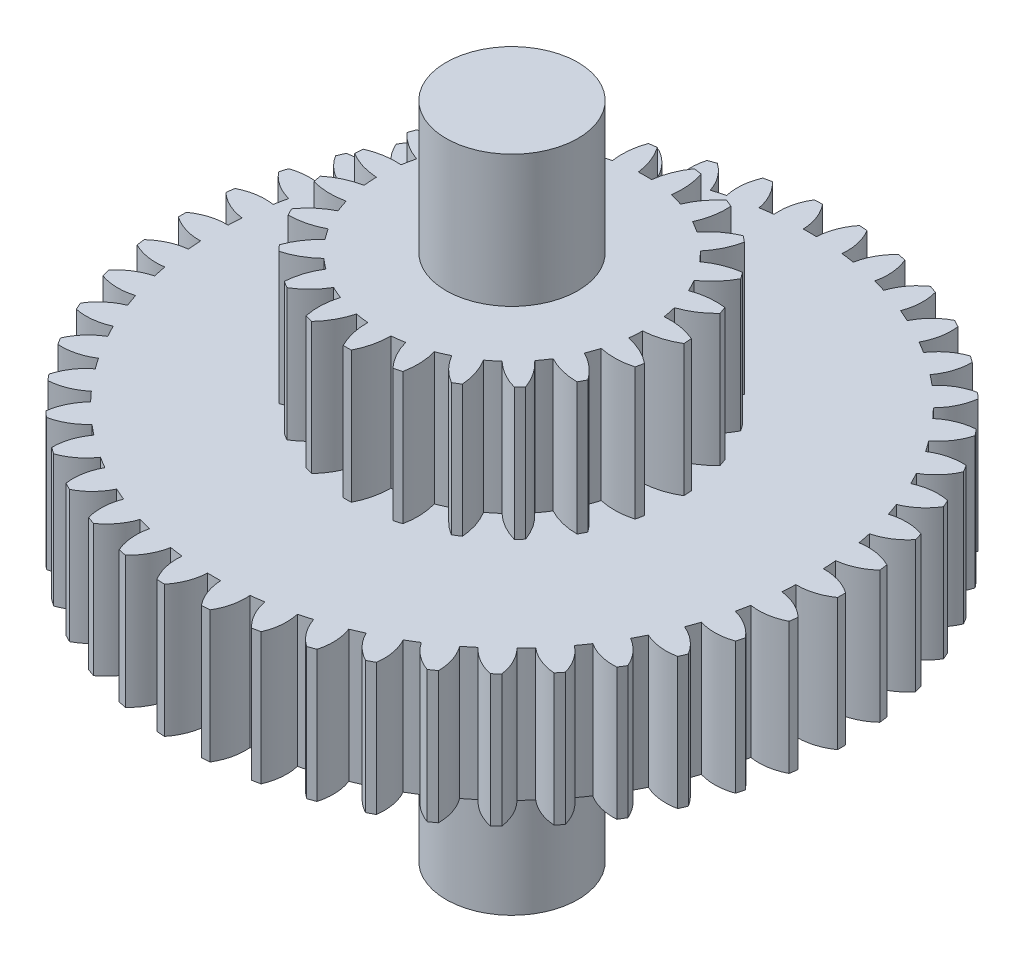
from build123d import *

# Parameters (mm, degrees)
BOSS_EXTRUDE1_DEPTH      = 1
BOSS_EXTRUDE2_DEPTH      = 2
BOSS_EXTRUDE2_DEPTH_BACK = 3
SKETCH2_R                = 0.5
BOSS_EXTRUDE3_DEPTH      = 1
SCALE1_SCALE             = 2
CUT_EXTRUDE1_DEPTH       = 2.5


with BuildPart() as part:
    # Sketch1 → Boss-Extrude1 (new body)
    with BuildSketch(Plane(origin=(0, 0, 0), x_dir=(1, 0, 0), z_dir=(0, 1, 0))):
        with BuildLine():
            ThreePointArc((-1.122849348, 2.23365381), (-1.150162594, 2.219713046), (-1.17730279, 2.20543831))
            ThreePointArc((-1.17730279, 2.20543831), (-1.174225974, 2.07727607), (-1.131251341, 1.956494417))
            ThreePointArc((-1.131251341, 1.956494417), (-1.174259727, 1.930987854), (-1.216693282, 1.904536022))
            ThreePointArc((-1.216693282, 1.904536022), (-1.3041624, 1.998259979), (-1.416540223, 2.059954804))
            ThreePointArc((-1.416540223, 2.059954804), (-1.441700805, 2.042424733), (-1.466644473, 2.024587363))
            ThreePointArc((-1.466644473, 2.024587363), (-1.446144892, 1.898037792), (-1.387124094, 1.784232818))
            ThreePointArc((-1.387124094, 1.784232818), (-1.426258754, 1.753107517), (-1.464695223, 1.721124023))
            ThreePointArc((-1.464695223, 1.721124023), (-1.564111726, 1.802064654), (-1.683843634, 1.847882739))
            ThreePointArc((-1.683843634, 1.847882739), (-1.706382858, 1.827089911), (-1.728665344, 1.806022184))
            ThreePointArc((-1.728665344, 1.806022184), (-1.691124866, 1.683442662), (-1.617157349, 1.578734337))
            ThreePointArc((-1.617157349, 1.578734337), (-1.651689279, 1.542570104), (-1.685412664, 1.505650741))
            ThreePointArc((-1.685412664, 1.505650741), (-1.79492461, 1.572300274), (-1.919780224, 1.601388114))
            ThreePointArc((-1.919780224, 1.601388114), (-1.939278227, 1.577719861), (-1.958484451, 1.553814228))
            ThreePointArc((-1.958484451, 1.553814228), (-1.904602384, 1.43748818), (-1.817066023, 1.343827023))
            ThreePointArc((-1.817066023, 1.343827023), (-1.846351958, 1.303297528), (-1.874734055, 1.262130034))
            ThreePointArc((-1.874734055, 1.262130034), (-1.992301445, 1.313246914), (-2.119954941, 1.325062658))
            ThreePointArc((-2.119954941, 1.325062658), (-2.136048511, 1.298959875), (-2.151820698, 1.272661654))
            ThreePointArc((-2.151820698, 1.272661654), (-2.082600763, 1.164756013), (-1.983126195, 1.083886754))
            ThreePointArc((-1.983126195, 1.083886754), (-2.006620594, 1.039746985), (-2.029132698, 0.995098232))
            ThreePointArc((-2.029132698, 0.995098232), (-2.152565474, 1.02973025), (-2.280638908, 1.024053793))
            ThreePointArc((-2.280638908, 1.024053793), (-2.293028254, 0.996002725), (-2.305072596, 0.967801801))
            ThreePointArc((-2.305072596, 0.967801801), (-2.22180423, 0.870326645), (-2.112244478, 0.803755726))
            ThreePointArc((-2.112244478, 0.803755726), (-2.129509684, 0.756827924), (-2.145732439, 0.709529634))
            ThreePointArc((-2.145732439, 0.709529634), (-2.272731281, 0.727031659), (-2.398838888, 0.703968742))
            ThreePointArc((-2.398838888, 0.703968742), (-2.407293218, 0.674491928), (-2.415385354, 0.644913631))
            ThreePointArc((-2.415385354, 0.644913631), (-2.319619689, 0.559684739), (-2.202015642, 0.508652249))
            ThreePointArc((-2.202015642, 0.508652249), (-2.212730038, 0.459810589), (-2.222361244, 0.41074384))
            ThreePointArc((-2.222361244, 0.41074384), (-2.350560404, 0.410789844), (-2.472353038, 0.370770087))
            ThreePointArc((-2.472353038, 0.370770087), (-2.476714865, 0.340416623), (-2.480704053, 0.310011941))
            ThreePointArc((-2.480704053, 0.310011941), (-2.374225021, 0.238616965), (-2.250767422, 0.204073543))
            ThreePointArc((-2.250767422, 0.204073543), (-2.254731418, 0.154227854), (-2.257591664, 0.104306666))
            ThreePointArc((-2.257591664, 0.104306666), (-2.384603034, 0.086895792), (-2.499811928, 0.030664685))
            ThreePointArc((-2.499811928, 0.030664685), (-2.5, 0), (-2.499811928, -0.030664685))
            ThreePointArc((-2.499811928, -0.030664685), (-2.384603034, -0.086895792), (-2.257591664, -0.104306666))
            ThreePointArc((-2.257591664, -0.104306666), (-2.254731418, -0.154227854), (-2.250767422, -0.204073543))
            ThreePointArc((-2.250767422, -0.204073543), (-2.374225021, -0.238616965), (-2.480704053, -0.310011941))
            ThreePointArc((-2.480704053, -0.310011941), (-2.476714865, -0.340416623), (-2.472353038, -0.370770087))
            ThreePointArc((-2.472353038, -0.370770087), (-2.350560404, -0.410789844), (-2.222361244, -0.41074384))
            ThreePointArc((-2.222361244, -0.41074384), (-2.212730038, -0.459810589), (-2.202015642, -0.508652249))
            ThreePointArc((-2.202015642, -0.508652249), (-2.319619689, -0.559684739), (-2.415385354, -0.644913631))
            ThreePointArc((-2.415385354, -0.644913631), (-2.407293218, -0.674491928), (-2.398838888, -0.703968742))
            ThreePointArc((-2.398838888, -0.703968742), (-2.272731281, -0.727031659), (-2.145732439, -0.709529634))
            ThreePointArc((-2.145732439, -0.709529634), (-2.129509684, -0.756827924), (-2.112244478, -0.803755726))
            ThreePointArc((-2.112244478, -0.803755726), (-2.22180423, -0.870326645), (-2.305072596, -0.967801801))
            ThreePointArc((-2.305072596, -0.967801801), (-2.293028254, -0.996002725), (-2.280638908, -1.024053793))
            ThreePointArc((-2.280638908, -1.024053793), (-2.152565474, -1.02973025), (-2.029132698, -0.995098232))
            ThreePointArc((-2.029132698, -0.995098232), (-2.006620594, -1.039746985), (-1.983126195, -1.083886754))
            ThreePointArc((-1.983126195, -1.083886754), (-2.082600763, -1.164756013), (-2.151820698, -1.272661654))
            ThreePointArc((-2.151820698, -1.272661654), (-2.136048511, -1.298959875), (-2.119954941, -1.325062658))
            ThreePointArc((-2.119954941, -1.325062658), (-1.992301445, -1.313246914), (-1.874734055, -1.262130034))
            ThreePointArc((-1.874734055, -1.262130034), (-1.846351958, -1.303297528), (-1.817066023, -1.343827023))
            ThreePointArc((-1.817066023, -1.343827023), (-1.904602384, -1.43748818), (-1.958484451, -1.553814228))
            ThreePointArc((-1.958484451, -1.553814228), (-1.939278227, -1.577719861), (-1.919780224, -1.601388114))
            ThreePointArc((-1.919780224, -1.601388114), (-1.79492461, -1.572300274), (-1.685412664, -1.505650741))
            ThreePointArc((-1.685412664, -1.505650741), (-1.651689279, -1.542570104), (-1.617157349, -1.578734337))
            ThreePointArc((-1.617157349, -1.578734337), (-1.691124866, -1.683442662), (-1.728665344, -1.806022184))
            ThreePointArc((-1.728665344, -1.806022184), (-1.706382858, -1.827089911), (-1.683843634, -1.847882739))
            ThreePointArc((-1.683843634, -1.847882739), (-1.564111726, -1.802064654), (-1.464695223, -1.721124023))
            ThreePointArc((-1.464695223, -1.721124023), (-1.426258754, -1.753107517), (-1.387124094, -1.784232818))
            ThreePointArc((-1.387124094, -1.784232818), (-1.446144892, -1.898037792), (-1.466644473, -2.024587363))
            ThreePointArc((-1.466644473, -2.024587363), (-1.441700805, -2.042424733), (-1.416540223, -2.059954804))
            ThreePointArc((-1.416540223, -2.059954804), (-1.3041624, -1.998259979), (-1.216693282, -1.904536022))
            ThreePointArc((-1.216693282, -1.904536022), (-1.174259727, -1.930987854), (-1.131251341, -1.956494417))
            ThreePointArc((-1.131251341, -1.956494417), (-1.174225974, -2.07727607), (-1.17730279, -2.20543831))
            ThreePointArc((-1.17730279, -2.20543831), (-1.150162594, -2.219713046), (-1.122849348, -2.23365381))
            ThreePointArc((-1.122849348, -2.23365381), (-1.019918995, -2.157231501), (-0.946026647, -2.052470118))
            ThreePointArc((-0.946026647, -2.052470118), (-0.900386463, -2.072897541), (-0.854305516, -2.092310227))
            ThreePointArc((-0.854305516, -2.092310227), (-0.880433448, -2.217818624), (-0.866030184, -2.345206115))
            ThreePointArc((-0.866030184, -2.345206115), (-0.83719903, -2.355652305), (-0.808241914, -2.365744071))
            ThreePointArc((-0.808241914, -2.365744071), (-0.71667643, -2.276017883), (-0.657737325, -2.162170579))
            ThreePointArc((-0.657737325, -2.162170579), (-0.609740703, -2.176193069), (-0.561445596, -2.189150256))
            ThreePointArc((-0.561445596, -2.189150256), (-0.570240113, -2.317047414), (-0.538625074, -2.441287167))
            ThreePointArc((-0.538625074, -2.441287167), (-0.508640033, -2.447710219), (-0.478578463, -2.453764996))
            ThreePointArc((-0.478578463, -2.453764996), (-0.400083539, -2.352406357), (-0.357195602, -2.231593893))
            ThreePointArc((-0.357195602, -2.231593893), (-0.307736627, -2.238950238), (-0.258127007, -2.245210558))
            ThreePointArc((-0.258127007, -2.245210558), (-0.249424284, -2.373113995), (-0.201186398, -2.491891658))
            ThreePointArc((-0.201186398, -2.491891658), (-0.170606033, -2.494171923), (-0.14, -2.496076922))
            ThreePointArc((-0.14, -2.496076922), (-0.076037848, -2.384973952), (-0.05, -2.259446835))
            ThreePointArc((-0.05, -2.259446835), (0, -2.26), (0.05, -2.259446835))
            ThreePointArc((0.05, -2.259446835), (0.076037848, -2.384973952), (0.14, -2.496076922))
            ThreePointArc((0.14, -2.496076922), (0.170606033, -2.494171923), (0.201186398, -2.491891658))
            ThreePointArc((0.201186398, -2.491891658), (0.249424284, -2.373113995), (0.258127007, -2.245210558))
            ThreePointArc((0.258127007, -2.245210558), (0.307736627, -2.238950238), (0.357195602, -2.231593893))
            ThreePointArc((0.357195602, -2.231593893), (0.400083539, -2.352406357), (0.478578463, -2.453764996))
            ThreePointArc((0.478578463, -2.453764996), (0.508640033, -2.447710219), (0.538625074, -2.441287167))
            ThreePointArc((0.538625074, -2.441287167), (0.570240113, -2.317047414), (0.561445596, -2.189150256))
            ThreePointArc((0.561445596, -2.189150256), (0.609740703, -2.176193069), (0.657737325, -2.162170579))
            ThreePointArc((0.657737325, -2.162170579), (0.71667643, -2.276017883), (0.808241914, -2.365744071))
            ThreePointArc((0.808241914, -2.365744071), (0.83719903, -2.355652305), (0.866030184, -2.345206115))
            ThreePointArc((0.866030184, -2.345206115), (0.880433448, -2.217818624), (0.854305516, -2.092310227))
            ThreePointArc((0.854305516, -2.092310227), (0.900386463, -2.072897541), (0.946026647, -2.052470118))
            ThreePointArc((0.946026647, -2.052470118), (1.019918995, -2.157231501), (1.122849348, -2.23365381))
            ThreePointArc((1.122849348, -2.23365381), (1.150162594, -2.219713046), (1.17730279, -2.20543831))
            ThreePointArc((1.17730279, -2.20543831), (1.174225974, -2.07727607), (1.131251341, -1.956494417))
            ThreePointArc((1.131251341, -1.956494417), (1.174259727, -1.930987854), (1.216693282, -1.904536022))
            ThreePointArc((1.216693282, -1.904536022), (1.3041624, -1.998259979), (1.416540223, -2.059954804))
            ThreePointArc((1.416540223, -2.059954804), (1.441700805, -2.042424733), (1.466644473, -2.024587363))
            ThreePointArc((1.466644473, -2.024587363), (1.446144892, -1.898037792), (1.387124094, -1.784232818))
            ThreePointArc((1.387124094, -1.784232818), (1.426258754, -1.753107517), (1.464695223, -1.721124023))
            ThreePointArc((1.464695223, -1.721124023), (1.564111726, -1.802064654), (1.683843634, -1.847882739))
            ThreePointArc((1.683843634, -1.847882739), (1.706382858, -1.827089911), (1.728665344, -1.806022184))
            ThreePointArc((1.728665344, -1.806022184), (1.691124866, -1.683442662), (1.617157349, -1.578734337))
            ThreePointArc((1.617157349, -1.578734337), (1.651689279, -1.542570104), (1.685412664, -1.505650741))
            ThreePointArc((1.685412664, -1.505650741), (1.79492461, -1.572300274), (1.919780224, -1.601388114))
            ThreePointArc((1.919780224, -1.601388114), (1.939278227, -1.577719861), (1.958484451, -1.553814228))
            ThreePointArc((1.958484451, -1.553814228), (1.904602384, -1.43748818), (1.817066023, -1.343827023))
            ThreePointArc((1.817066023, -1.343827023), (1.846351958, -1.303297528), (1.874734055, -1.262130034))
            ThreePointArc((1.874734055, -1.262130034), (1.992301445, -1.313246914), (2.119954941, -1.325062658))
            ThreePointArc((2.119954941, -1.325062658), (2.136048511, -1.298959875), (2.151820698, -1.272661654))
            ThreePointArc((2.151820698, -1.272661654), (2.082600763, -1.164756013), (1.983126195, -1.083886754))
            ThreePointArc((1.983126195, -1.083886754), (2.006620594, -1.039746985), (2.029132698, -0.995098232))
            ThreePointArc((2.029132698, -0.995098232), (2.152565474, -1.02973025), (2.280638908, -1.024053793))
            ThreePointArc((2.280638908, -1.024053793), (2.293028254, -0.996002725), (2.305072596, -0.967801801))
            ThreePointArc((2.305072596, -0.967801801), (2.22180423, -0.870326645), (2.112244478, -0.803755726))
            ThreePointArc((2.112244478, -0.803755726), (2.129509684, -0.756827924), (2.145732439, -0.709529634))
            ThreePointArc((2.145732439, -0.709529634), (2.272731281, -0.727031659), (2.398838888, -0.703968742))
            ThreePointArc((2.398838888, -0.703968742), (2.407293218, -0.674491928), (2.415385354, -0.644913631))
            ThreePointArc((2.415385354, -0.644913631), (2.319619689, -0.559684739), (2.202015642, -0.508652249))
            ThreePointArc((2.202015642, -0.508652249), (2.212730038, -0.459810589), (2.222361244, -0.41074384))
            ThreePointArc((2.222361244, -0.41074384), (2.350560404, -0.410789844), (2.472353038, -0.370770087))
            ThreePointArc((2.472353038, -0.370770087), (2.476714865, -0.340416623), (2.480704053, -0.310011941))
            ThreePointArc((2.480704053, -0.310011941), (2.374225021, -0.238616965), (2.250767422, -0.204073543))
            ThreePointArc((2.250767422, -0.204073543), (2.254731418, -0.154227854), (2.257591664, -0.104306666))
            ThreePointArc((2.257591664, -0.104306666), (2.384603034, -0.086895792), (2.499811928, -0.030664685))
            ThreePointArc((2.499811928, -0.030664685), (2.5, 0), (2.499811928, 0.030664685))
            ThreePointArc((2.499811928, 0.030664685), (2.384603034, 0.086895792), (2.257591664, 0.104306666))
            ThreePointArc((2.257591664, 0.104306666), (2.254731418, 0.154227854), (2.250767422, 0.204073543))
            ThreePointArc((2.250767422, 0.204073543), (2.374225021, 0.238616965), (2.480704053, 0.310011941))
            ThreePointArc((2.480704053, 0.310011941), (2.476714865, 0.340416623), (2.472353038, 0.370770087))
            ThreePointArc((2.472353038, 0.370770087), (2.350560404, 0.410789844), (2.222361244, 0.41074384))
            ThreePointArc((2.222361244, 0.41074384), (2.212730038, 0.459810589), (2.202015642, 0.508652249))
            ThreePointArc((2.202015642, 0.508652249), (2.319619689, 0.559684739), (2.415385354, 0.644913631))
            ThreePointArc((2.415385354, 0.644913631), (2.407293218, 0.674491928), (2.398838888, 0.703968742))
            ThreePointArc((2.398838888, 0.703968742), (2.272731281, 0.727031659), (2.145732439, 0.709529634))
            ThreePointArc((2.145732439, 0.709529634), (2.129509684, 0.756827924), (2.112244478, 0.803755726))
            ThreePointArc((2.112244478, 0.803755726), (2.22180423, 0.870326645), (2.305072596, 0.967801801))
            ThreePointArc((2.305072596, 0.967801801), (2.293028254, 0.996002725), (2.280638908, 1.024053793))
            ThreePointArc((2.280638908, 1.024053793), (2.152565474, 1.02973025), (2.029132698, 0.995098232))
            ThreePointArc((2.029132698, 0.995098232), (2.006620594, 1.039746985), (1.983126195, 1.083886754))
            ThreePointArc((1.983126195, 1.083886754), (2.082600763, 1.164756013), (2.151820698, 1.272661654))
            ThreePointArc((2.151820698, 1.272661654), (2.136048511, 1.298959875), (2.119954941, 1.325062658))
            ThreePointArc((2.119954941, 1.325062658), (1.992301445, 1.313246914), (1.874734055, 1.262130034))
            ThreePointArc((1.874734055, 1.262130034), (1.846351958, 1.303297528), (1.817066023, 1.343827023))
            ThreePointArc((1.817066023, 1.343827023), (1.904602384, 1.43748818), (1.958484451, 1.553814228))
            ThreePointArc((1.958484451, 1.553814228), (1.939278227, 1.577719861), (1.919780224, 1.601388114))
            ThreePointArc((1.919780224, 1.601388114), (1.79492461, 1.572300274), (1.685412664, 1.505650741))
            ThreePointArc((1.685412664, 1.505650741), (1.651689279, 1.542570104), (1.617157349, 1.578734337))
            ThreePointArc((1.617157349, 1.578734337), (1.691124866, 1.683442662), (1.728665344, 1.806022184))
            ThreePointArc((1.728665344, 1.806022184), (1.706382858, 1.827089911), (1.683843634, 1.847882739))
            ThreePointArc((1.683843634, 1.847882739), (1.564111726, 1.802064654), (1.464695223, 1.721124023))
            ThreePointArc((1.464695223, 1.721124023), (1.426258754, 1.753107517), (1.387124094, 1.784232818))
            ThreePointArc((1.387124094, 1.784232818), (1.446144892, 1.898037792), (1.466644473, 2.024587363))
            ThreePointArc((1.466644473, 2.024587363), (1.441700805, 2.042424733), (1.416540223, 2.059954804))
            ThreePointArc((1.416540223, 2.059954804), (1.3041624, 1.998259979), (1.216693282, 1.904536022))
            ThreePointArc((1.216693282, 1.904536022), (1.174259727, 1.930987854), (1.131251341, 1.956494417))
            ThreePointArc((1.131251341, 1.956494417), (1.174225974, 2.07727607), (1.17730279, 2.20543831))
            ThreePointArc((1.17730279, 2.20543831), (1.150162594, 2.219713046), (1.122849348, 2.23365381))
            ThreePointArc((1.122849348, 2.23365381), (1.019918995, 2.157231501), (0.946026647, 2.052470118))
            ThreePointArc((0.946026647, 2.052470118), (0.900386463, 2.072897541), (0.854305516, 2.092310227))
            ThreePointArc((0.854305516, 2.092310227), (0.880433448, 2.217818624), (0.866030184, 2.345206115))
            ThreePointArc((0.866030184, 2.345206115), (0.83719903, 2.355652305), (0.808241914, 2.365744071))
            ThreePointArc((0.808241914, 2.365744071), (0.71667643, 2.276017883), (0.657737325, 2.162170579))
            ThreePointArc((0.657737325, 2.162170579), (0.609740703, 2.176193069), (0.561445596, 2.189150256))
            ThreePointArc((0.561445596, 2.189150256), (0.570240113, 2.317047414), (0.538625074, 2.441287167))
            ThreePointArc((0.538625074, 2.441287167), (0.508640033, 2.447710219), (0.478578463, 2.453764996))
            ThreePointArc((0.478578463, 2.453764996), (0.400083539, 2.352406357), (0.357195602, 2.231593893))
            ThreePointArc((0.357195602, 2.231593893), (0.307736627, 2.238950238), (0.258127007, 2.245210558))
            ThreePointArc((0.258127007, 2.245210558), (0.249424284, 2.373113995), (0.201186398, 2.491891658))
            ThreePointArc((0.201186398, 2.491891658), (0.170606033, 2.494171923), (0.14, 2.496076922))
            ThreePointArc((0.14, 2.496076922), (0.076037848, 2.384973952), (0.05, 2.259446835))
            ThreePointArc((0.05, 2.259446835), (0, 2.26), (-0.05, 2.259446835))
            ThreePointArc((-0.05, 2.259446835), (-0.076037848, 2.384973952), (-0.14, 2.496076922))
            ThreePointArc((-0.14, 2.496076922), (-0.170606033, 2.494171923), (-0.201186398, 2.491891658))
            ThreePointArc((-0.201186398, 2.491891658), (-0.249424284, 2.373113995), (-0.258127007, 2.245210558))
            ThreePointArc((-0.258127007, 2.245210558), (-0.307736627, 2.238950238), (-0.357195602, 2.231593893))
            ThreePointArc((-0.357195602, 2.231593893), (-0.400083539, 2.352406357), (-0.478578463, 2.453764996))
            ThreePointArc((-0.478578463, 2.453764996), (-0.508640033, 2.447710219), (-0.538625074, 2.441287167))
            ThreePointArc((-0.538625074, 2.441287167), (-0.570240113, 2.317047414), (-0.561445596, 2.189150256))
            ThreePointArc((-0.561445596, 2.189150256), (-0.609740703, 2.176193069), (-0.657737325, 2.162170579))
            ThreePointArc((-0.657737325, 2.162170579), (-0.71667643, 2.276017883), (-0.808241914, 2.365744071))
            ThreePointArc((-0.808241914, 2.365744071), (-0.83719903, 2.355652305), (-0.866030184, 2.345206115))
            ThreePointArc((-0.866030184, 2.345206115), (-0.880433448, 2.217818624), (-0.854305516, 2.092310227))
            ThreePointArc((-0.854305516, 2.092310227), (-0.900386463, 2.072897541), (-0.946026647, 2.052470118))
            ThreePointArc((-0.946026647, 2.052470118), (-1.019918995, 2.157231501), (-1.122849348, 2.23365381))
        make_face()
    extrude(amount=BOSS_EXTRUDE1_DEPTH)

    # Sketch2 → Boss-Extrude2 (add, two sides: drawn at the far end of the back side and taken through both)
    with BuildSketch(Plane.XZ.offset(-BOSS_EXTRUDE2_DEPTH_BACK)):
        with Locations(Location((0, 0, 0), (0, 0, 270))):
            Circle(SKETCH2_R)
    extrude(amount=BOSS_EXTRUDE2_DEPTH + BOSS_EXTRUDE2_DEPTH_BACK)

    # Sketch3 → Boss-Extrude3 (add)
    with BuildSketch(Plane(origin=(0, 1, 0), x_dir=(1, 0, 0), z_dir=(0, 1, 0))):
        with BuildLine():
            ThreePointArc((-0.765012261, 0.988562715), (-0.78885993, 0.969639113), (-0.812239679, 0.95014036))
            ThreePointArc((-0.812239679, 0.95014036), (-0.771519926, 0.830895064), (-0.703111612, 0.725075211))
            ThreePointArc((-0.703111612, 0.725075211), (-0.738144324, 0.689378675), (-0.771366926, 0.651991614))
            ThreePointArc((-0.771366926, 0.651991614), (-0.881608438, 0.71301905), (-1.003354559, 0.74550629))
            ThreePointArc((-1.003354559, 0.74550629), (-1.021212366, 0.720850403), (-1.03846443, 0.695766935))
            ThreePointArc((-1.03846443, 0.695766935), (-0.96708268, 0.591929637), (-0.872661277, 0.508490212))
            ThreePointArc((-0.872661277, 0.508490212), (-0.896764071, 0.464665688), (-0.918667781, 0.41970169))
            ThreePointArc((-0.918667781, 0.41970169), (-1.041286243, 0.44872326), (-1.16728264, 0.447159074))
            ThreePointArc((-1.16728264, 0.447159074), (-1.177826153, 0.418599515), (-1.187671024, 0.38979166))
            ThreePointArc((-1.187671024, 0.38979166), (-1.090921335, 0.309063496), (-0.977489647, 0.254192821))
            ThreePointArc((-0.977489647, 0.254192821), (-0.988874929, 0.205490573), (-0.997835248, 0.156284412))
            ThreePointArc((-0.997835248, 0.156284412), (-1.123736611, 0.151147718), (-1.244638708, 0.115648115))
            ThreePointArc((-1.244638708, 0.115648115), (-1.247085961, 0.085303017), (-1.248793492, 0.05490732))
            ThreePointArc((-1.248793492, 0.05490732), (-1.133851346, 0.003275529), (-1.009822082, -0.018956889))
            ThreePointArc((-1.009822082, -0.018956889), (-1.007645457, -0.068924837), (-1.00299784, -0.118723766))
            ThreePointArc((-1.00299784, -0.118723766), (-1.122844575, -0.157637759), (-1.229685616, -0.224439935))
            ThreePointArc((-1.229685616, -0.224439935), (-1.22385511, -0.254320016), (-1.21729866, -0.284049244))
            ThreePointArc((-1.21729866, -0.284049244), (-1.092688789, -0.302755369), (-0.967260632, -0.290700653))
            ThreePointArc((-0.967260632, -0.290700653), (-0.951683531, -0.338228408), (-0.933772671, -0.384926745))
            ThreePointArc((-0.933772671, -0.384926745), (-1.038676294, -0.454731964), (-1.123532368, -0.547882303))
            ThreePointArc((-1.123532368, -0.547882303), (-1.109856523, -0.575081297), (-1.095522354, -0.601939176))
            ThreePointArc((-1.095522354, -0.601939176), (-0.970486504, -0.586332286), (-0.852961886, -0.54088448))
            ThreePointArc((-0.852961886, -0.54088448), (-0.825139592, -0.582447125), (-0.795293854, -0.622581469))
            ThreePointArc((-0.795293854, -0.622581469), (-0.877474144, -0.71810078), (-0.934051864, -0.830690746))
            ThreePointArc((-0.934051864, -0.830690746), (-0.913544955, -0.853191429), (-0.892496167, -0.875186032))
            ThreePointArc((-0.892496167, -0.875186032), (-0.776307675, -0.826423619), (-0.67540286, -0.750953379))
            ThreePointArc((-0.67540286, -0.750953379), (-0.637398824, -0.783468404), (-0.597831731, -0.814062173))
            ThreePointArc((-0.597831731, -0.814062173), (-0.651193751, -0.928211346), (-0.675297006, -1.051890657))
            ThreePointArc((-0.675297006, -1.051890657), (-0.649479938, -1.068024256), (-0.623277623, -1.083524344))
            ThreePointArc((-0.623277623, -1.083524344), (-0.524553656, -1.005222894), (-0.447752293, -0.905327501))
            ThreePointArc((-0.447752293, -0.905327501), (-0.402385101, -0.926383415), (-0.356031163, -0.94516761))
            ThreePointArc((-0.356031163, -0.94516761), (-0.376617296, -1.069480723), (-0.366458458, -1.19507665))
            ThreePointArc((-0.366458458, -1.19507665), (-0.337245964, -1.203646609), (-0.307833428, -1.211502613))
            ThreePointArc((-0.307833428, -1.211502613), (-0.233895893, -1.109469385), (-0.186893986, -0.992557624))
            ThreePointArc((-0.186893986, -0.992557624), (-0.137528316, -1.000592805), (-0.087825392, -1.006174289))
            ThreePointArc((-0.087825392, -1.006174289), (-0.074108859, -1.131431607), (-0.030441363, -1.249629274))
            ThreePointArc((-0.030441363, -1.249629274), (0, -1.25), (0.030441363, -1.249629274))
            ThreePointArc((0.030441363, -1.249629274), (0.074108859, -1.131431607), (0.087825392, -1.006174289))
            ThreePointArc((0.087825392, -1.006174289), (0.137528316, -1.000592805), (0.186893986, -0.992557624))
            ThreePointArc((0.186893986, -0.992557624), (0.233895893, -1.109469385), (0.307833428, -1.211502613))
            ThreePointArc((0.307833428, -1.211502613), (0.337245964, -1.203646609), (0.366458458, -1.19507665))
            ThreePointArc((0.366458458, -1.19507665), (0.376617296, -1.069480723), (0.356031163, -0.94516761))
            ThreePointArc((0.356031163, -0.94516761), (0.402385101, -0.926383415), (0.447752293, -0.905327501))
            ThreePointArc((0.447752293, -0.905327501), (0.524553656, -1.005222894), (0.623277623, -1.083524344))
            ThreePointArc((0.623277623, -1.083524344), (0.649479938, -1.068024256), (0.675297006, -1.051890657))
            ThreePointArc((0.675297006, -1.051890657), (0.651193751, -0.928211346), (0.597831731, -0.814062173))
            ThreePointArc((0.597831731, -0.814062173), (0.637398824, -0.783468404), (0.67540286, -0.750953379))
            ThreePointArc((0.67540286, -0.750953379), (0.776307675, -0.826423619), (0.892496167, -0.875186032))
            ThreePointArc((0.892496167, -0.875186032), (0.913544955, -0.853191429), (0.934051864, -0.830690746))
            ThreePointArc((0.934051864, -0.830690746), (0.877474144, -0.71810078), (0.795293854, -0.622581469))
            ThreePointArc((0.795293854, -0.622581469), (0.825139592, -0.582447125), (0.852961886, -0.54088448))
            ThreePointArc((0.852961886, -0.54088448), (0.970486504, -0.586332286), (1.095522354, -0.601939176))
            ThreePointArc((1.095522354, -0.601939176), (1.109856523, -0.575081297), (1.123532368, -0.547882303))
            ThreePointArc((1.123532368, -0.547882303), (1.038676294, -0.454731964), (0.933772671, -0.384926745))
            ThreePointArc((0.933772671, -0.384926745), (0.951683531, -0.338228408), (0.967260632, -0.290700653))
            ThreePointArc((0.967260632, -0.290700653), (1.092688789, -0.302755369), (1.21729866, -0.284049244))
            ThreePointArc((1.21729866, -0.284049244), (1.22385511, -0.254320016), (1.229685616, -0.224439935))
            ThreePointArc((1.229685616, -0.224439935), (1.122844575, -0.157637759), (1.00299784, -0.118723766))
            ThreePointArc((1.00299784, -0.118723766), (1.007645457, -0.068924837), (1.009822082, -0.018956889))
            ThreePointArc((1.009822082, -0.018956889), (1.133851346, 0.003275529), (1.248793492, 0.05490732))
            ThreePointArc((1.248793492, 0.05490732), (1.247085961, 0.085303017), (1.244638708, 0.115648115))
            ThreePointArc((1.244638708, 0.115648115), (1.123736611, 0.151147718), (0.997835248, 0.156284412))
            ThreePointArc((0.997835248, 0.156284412), (0.988874929, 0.205490573), (0.977489647, 0.254192821))
            ThreePointArc((0.977489647, 0.254192821), (1.090921335, 0.309063496), (1.187671024, 0.38979166))
            ThreePointArc((1.187671024, 0.38979166), (1.177826153, 0.418599515), (1.16728264, 0.447159074))
            ThreePointArc((1.16728264, 0.447159074), (1.041286243, 0.44872326), (0.918667781, 0.41970169))
            ThreePointArc((0.918667781, 0.41970169), (0.896764071, 0.464665688), (0.872661277, 0.508490212))
            ThreePointArc((0.872661277, 0.508490212), (0.96708268, 0.591929637), (1.03846443, 0.695766935))
            ThreePointArc((1.03846443, 0.695766935), (1.021212366, 0.720850403), (1.003354559, 0.74550629))
            ThreePointArc((1.003354559, 0.74550629), (0.881608438, 0.71301905), (0.771366926, 0.651991614))
            ThreePointArc((0.771366926, 0.651991614), (0.738144324, 0.689378675), (0.703111612, 0.725075211))
            ThreePointArc((0.703111612, 0.725075211), (0.771519926, 0.830895064), (0.812239679, 0.95014036))
            ThreePointArc((0.812239679, 0.95014036), (0.78885993, 0.969639113), (0.765012261, 0.988562715))
            ThreePointArc((0.765012261, 0.988562715), (0.656545768, 0.92443348), (0.566857316, 0.835926303))
            ThreePointArc((0.566857316, 0.835926303), (0.52477979, 0.862963599), (0.481415375, 0.887884698))
            ThreePointArc((0.481415375, 0.887884698), (0.518737068, 1.008236806), (0.525774827, 1.134046221))
            ThreePointArc((0.525774827, 1.134046221), (0.498001362, 1.146514127), (0.469932502, 1.158301966))
            ThreePointArc((0.469932502, 1.158301966), (0.382790102, 1.067286907), (0.320306492, 0.957864161))
            ThreePointArc((0.320306492, 0.957864161), (0.272494739, 0.97254646), (0.224014763, 0.984843838))
            ThreePointArc((0.224014763, 0.984843838), (0.227481856, 1.110802237), (0.200315662, 1.233845061))
            ThreePointArc((0.200315662, 1.233845061), (0.170208311, 1.238357433), (0.14, 1.242135258))
            ThreePointArc((0.14, 1.242135258), (0.080644645, 1.130984547), (0.05, 1.008761617))
            ThreePointArc((0.05, 1.008761617), (0, 1.01), (-0.05, 1.008761617))
            ThreePointArc((-0.05, 1.008761617), (-0.080644645, 1.130984547), (-0.14, 1.242135258))
            ThreePointArc((-0.14, 1.242135258), (-0.170208311, 1.238357433), (-0.200315662, 1.233845061))
            ThreePointArc((-0.200315662, 1.233845061), (-0.227481856, 1.110802237), (-0.224014763, 0.984843838))
            ThreePointArc((-0.224014763, 0.984843838), (-0.272494739, 0.97254646), (-0.320306492, 0.957864161))
            ThreePointArc((-0.320306492, 0.957864161), (-0.382790102, 1.067286907), (-0.469932502, 1.158301966))
            ThreePointArc((-0.469932502, 1.158301966), (-0.498001362, 1.146514127), (-0.525774827, 1.134046221))
            ThreePointArc((-0.525774827, 1.134046221), (-0.518737068, 1.008236806), (-0.481415375, 0.887884698))
            ThreePointArc((-0.481415375, 0.887884698), (-0.52477979, 0.862963599), (-0.566857316, 0.835926303))
            ThreePointArc((-0.566857316, 0.835926303), (-0.656545768, 0.92443348), (-0.765012261, 0.988562715))
        make_face()
    extrude(amount=BOSS_EXTRUDE3_DEPTH)


with BuildPart() as part_1:
    # Scale1: scaled about (0, 0, 0)
    add(part.part.scale(SCALE1_SCALE))

    # Sketch4 → Cut-Extrude1 (cut)
    with BuildSketch(Plane.XZ.offset(4)):
        with BuildLine():
            Line((-0.75, 0), (-0.75, -0.661437828))
            ThreePointArc((-0.75, -0.661437828), (-1, 0), (-0.75, 0.661437828))
            Line((-0.75, 0.661437828), (-0.75, 0))
        make_face()
    extrude(amount=-CUT_EXTRUDE1_DEPTH, mode=Mode.SUBTRACT)


solid = part_1.part
